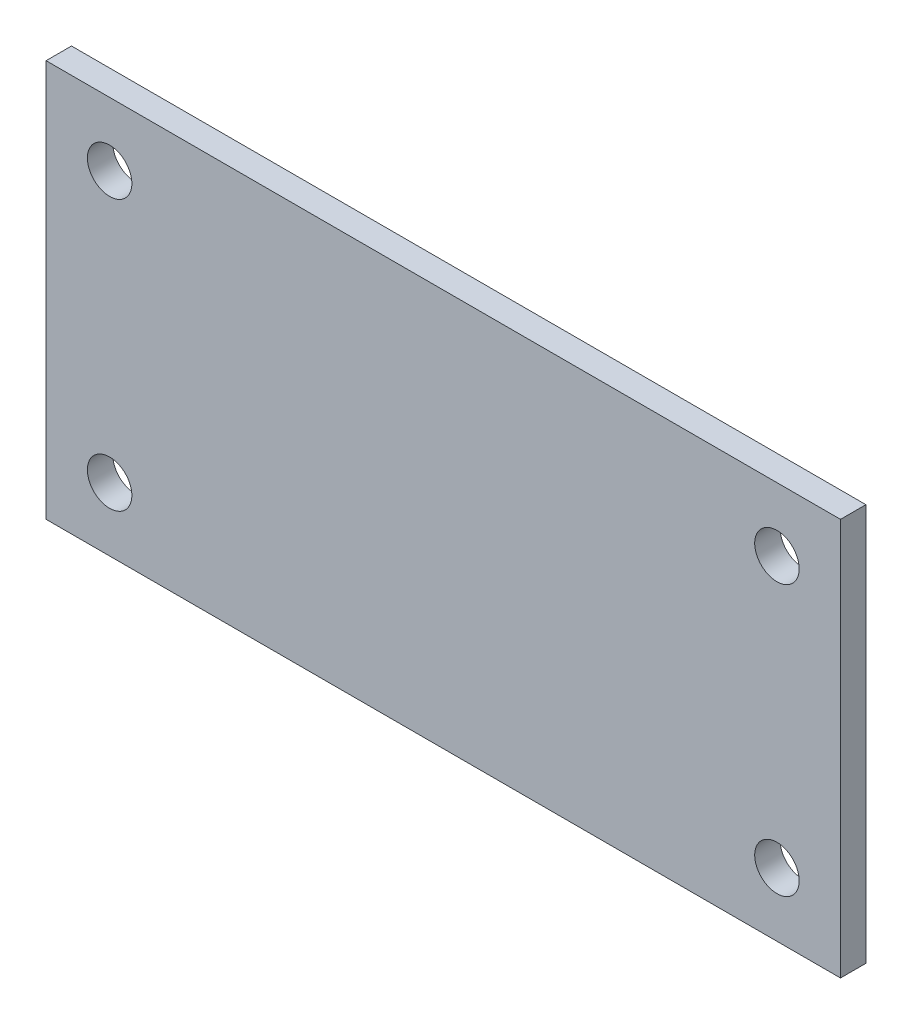
from build123d import *

# Parameters (mm, degrees)
SKETCH2_W                             = 50
SKETCH2_H                             = 25
GENERIC_ESP32_CARRIER_REFERENCE_DEPTH = 1.6
SKETCH3_R                             = 1.4
FOUR_M2P5_CLEARANCE_HOLES_DEPTH       = 28.996606937


with BuildPart() as part:
    # Sketch2 → Generic_ESP32_carrier_reference (new body)
    with BuildSketch(Plane.XY):
        Rectangle(SKETCH2_W, SKETCH2_H)
    extrude(amount=GENERIC_ESP32_CARRIER_REFERENCE_DEPTH)

    # Sketch3 → Four_M2p5_clearance_holes (cut, through all)
    with BuildSketch(Plane.XY):
        with Locations((-21, -8.5)):
            Circle(SKETCH3_R)
        with Locations((-21, 8.5)):
            Circle(SKETCH3_R)
        with Locations((21, -8.5)):
            Circle(SKETCH3_R)
        with Locations((21, 8.5)):
            Circle(SKETCH3_R)
    extrude(amount=FOUR_M2P5_CLEARANCE_HOLES_DEPTH, mode=Mode.SUBTRACT)


solid = part.part
